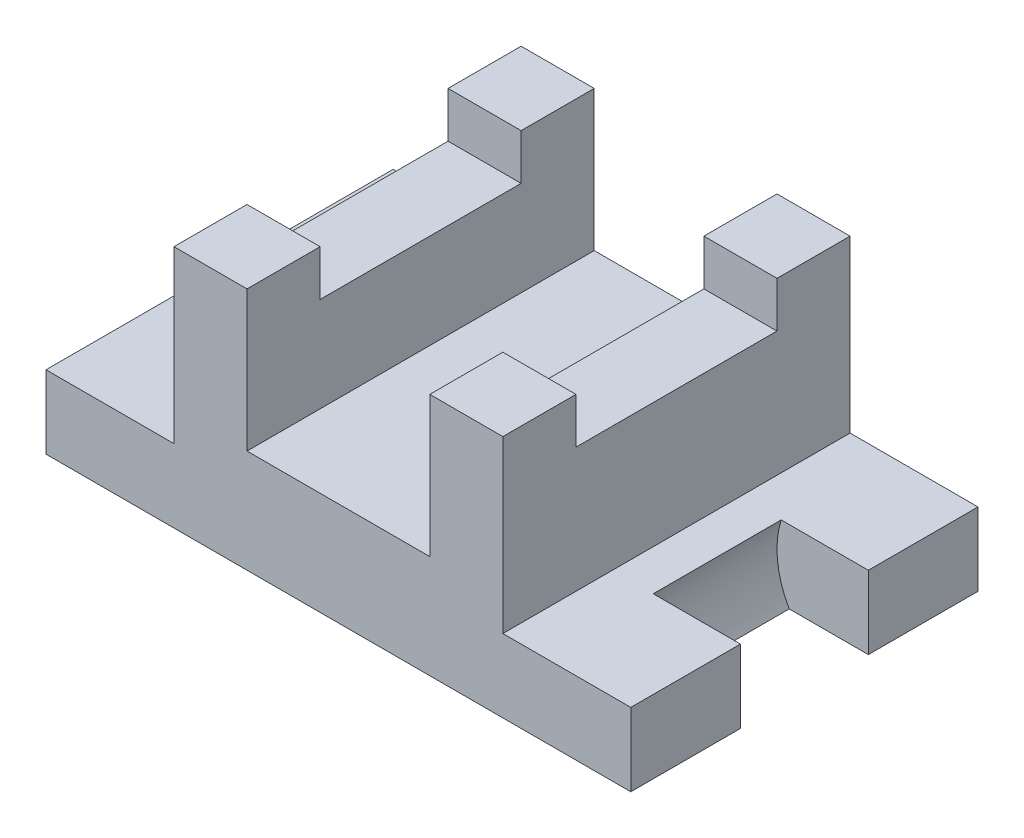
from build123d import *

# Parameters (mm, degrees)
BOSS_EXTRUDE1_DEPTH = 38
SKETCH2_W           = 22
SKETCH2_H           = 10
CUT_EXTRUDE1_DEPTH  = 76.040117824
SKETCH3_W           = 14
SKETCH3_H           = 10


with BuildPart() as part:
    # Sketch1 → Boss-Extrude1 (new body)
    with BuildSketch(Plane.XY):
        Polygon((4.047792592, 41.073340295), (-3.952207408, 41.073340295), (-3.952207408, 22.406673629), (-17.952207408, 22.406673629), (-17.952207408, 14.406673629), (46.047792592, 14.406673629), (46.047792592, 22.406673629), (32.047792592, 22.406673629), (32.047792592, 41.073340295), (24.047792592, 41.073340295), (24.047792592, 25.700791276), (4.047792592, 25.700791276), align=None)
    extrude(amount=BOSS_EXTRUDE1_DEPTH)

    # Sketch2 → Cut-Extrude1 (cut, through all)
    with BuildSketch(Plane(origin=(32.047792592, 0, 0), x_dir=(0, 0, -1), z_dir=(1, 0, 0))):
        with Locations((-19, 41.073340295)):
            Rectangle(SKETCH2_W, SKETCH2_H)
    extrude(amount=-CUT_EXTRUDE1_DEPTH, mode=Mode.SUBTRACT)

    # Sketch3 → Cut-Revolve1 (revolve, cut)
    with BuildSketch(Plane(origin=(46.047792592, 0, 0), x_dir=(0, 0, -1), z_dir=(1, 0, 0))):
        with Locations((-19, 14.406673629)):
            Rectangle(SKETCH3_W, SKETCH3_H)
    revolve(axis=Axis((46.047792592, 19.406673629, 12), (0, 0, 1)), mode=Mode.SUBTRACT)


solid = part.part
